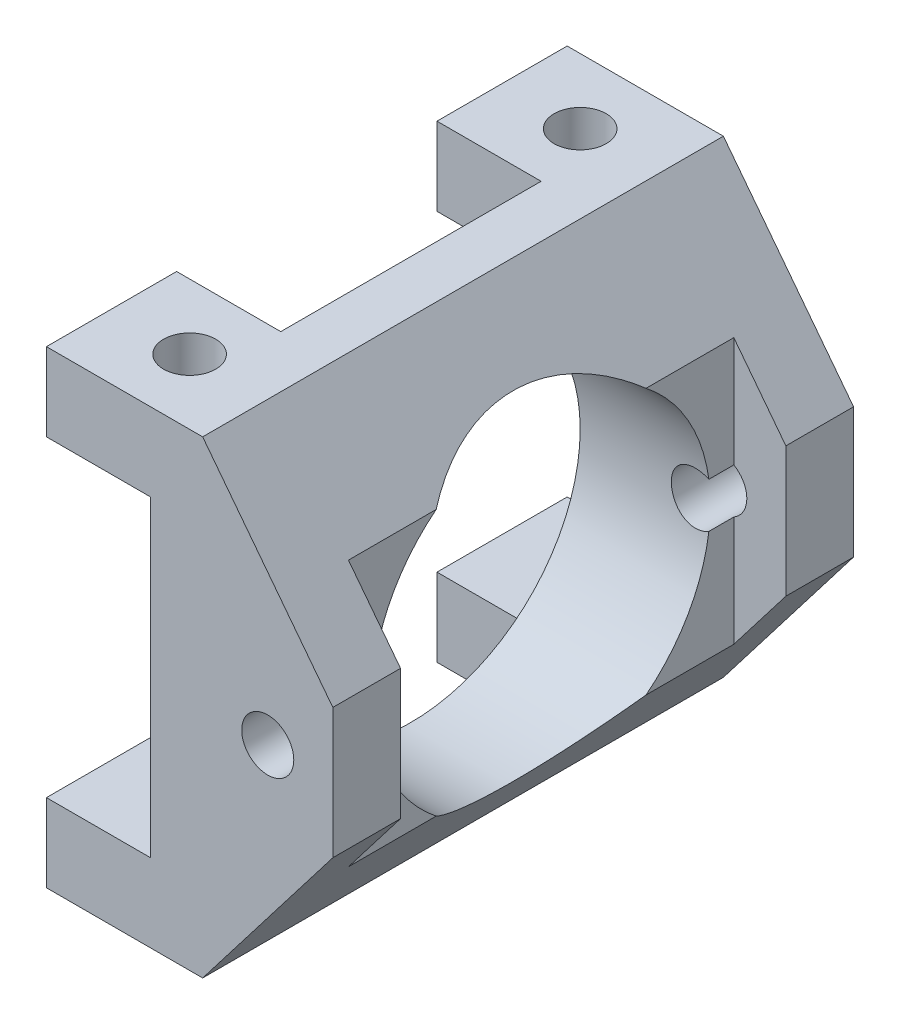
from build123d import *

# Parameters (mm, degrees)
SKETCH_1_W          = 20
SKETCH_1_H          = 18
EXTRUDE_1_DEPTH     = 5
SKETCH_2_R          = 6.5
CUT_EXTRUDE_1_DEPTH = 28.367864367
SKETCH_3_W          = 2.6
SKETCH_3_H          = 18
EXTRUDE_2_DEPTH     = 2
SKETCH_4_R          = 1
CUT_EXTRUDE_2_DEPTH = 28.802877549
CUT_EXTRUDE_3_DEPTH = 28.802877621
SKETCH_6_W          = 5
SKETCH_6_H          = 3
EXTRUDE_3_DEPTH     = 4
SKETCH_7_R          = 1
CUT_EXTRUDE_4_DEPTH = 28.802877621


with BuildPart() as part:
    # 草图1 → 凸台-拉伸1 (new body)
    with BuildSketch(Plane(origin=(0, 0, 0), x_dir=(0, 0, -1), z_dir=(1, 0, 0))):
        with Locations((10, -9)):
            Rectangle(SKETCH_1_W, SKETCH_1_H)
    extrude(amount=EXTRUDE_1_DEPTH)

    # 草图2 → 切除-拉伸1 (cut, through all)
    with BuildSketch(Plane(origin=(5, 0, 0), x_dir=(0, 0, -1), z_dir=(1, 0, 0))):
        with Locations((10, -9)):
            Circle(SKETCH_2_R)
    extrude(amount=-CUT_EXTRUDE_1_DEPTH, mode=Mode.SUBTRACT)

    # 草图3 → 凸台-拉伸2 (add)
    with BuildSketch(Plane(origin=(5, 0, 0), x_dir=(0, 0, -1), z_dir=(1, 0, 0))):
        with Locations((1.3, -9)):
            Rectangle(SKETCH_3_W, SKETCH_3_H)
        with Locations((18.7, -9)):
            Rectangle(SKETCH_3_W, SKETCH_3_H)
    extrude(amount=EXTRUDE_2_DEPTH)

    # 草图4 → 切除-拉伸2 (cut, through all)
    with BuildSketch(Plane.XY):
        with Locations((4.5, -9)):
            Circle(SKETCH_4_R)
    extrude(amount=-CUT_EXTRUDE_2_DEPTH, mode=Mode.SUBTRACT)

    # 草图5 → 切除-拉伸3 (cut, through all)
    with BuildSketch(Plane.XY):
        Polygon((7, 0), (2, 0), (7, -6.5), align=None)
        Polygon((7, -18), (7, -11.5), (2, -18), align=None)
    extrude(amount=-CUT_EXTRUDE_3_DEPTH, mode=Mode.SUBTRACT)

    # 草图6 → 凸台-拉伸3 (add)
    with BuildSketch(Plane.ZY):
        with Locations((-17.5, -16.5)):
            Rectangle(SKETCH_6_W, SKETCH_6_H)
        with Locations((-17.5, -1.5)):
            Rectangle(SKETCH_6_W, SKETCH_6_H)
        with Locations((-2.5, -1.5)):
            Rectangle(SKETCH_6_W, SKETCH_6_H)
        with Locations((-2.5, -16.5)):
            Rectangle(SKETCH_6_W, SKETCH_6_H)
    extrude(amount=EXTRUDE_3_DEPTH)

    # 草图7 → 切除-拉伸4 (cut, through all)
    with BuildSketch(Plane(origin=(0, 0, 0), x_dir=(1, 0, 0), z_dir=(0, 1, 0))):
        with Locations(Location((-1, 17.5, 0), (0, 0, 270))):
            Circle(SKETCH_7_R)
        with Locations(Location((-1, 2.5, 0), (0, 0, 270))):
            Circle(SKETCH_7_R)
    extrude(amount=-CUT_EXTRUDE_4_DEPTH, mode=Mode.SUBTRACT)


solid = part.part
